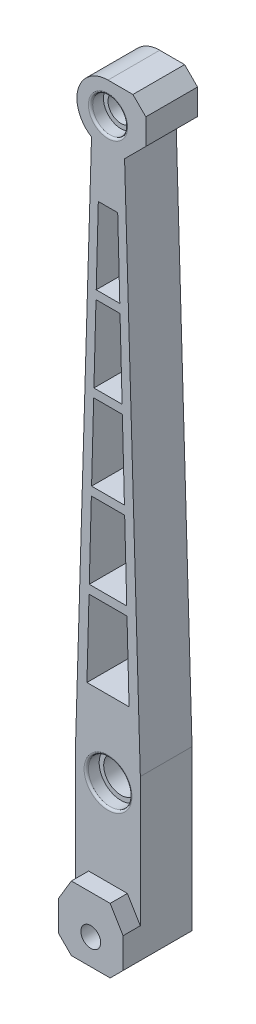
from build123d import *

# Parameters (mm, degrees)
SKETCH_1_R          = 2.3
EXTRUDE_1_DEPTH     = 12
SKETCH_2_R          = 5.05
CUT_EXTRUDE_1_DEPTH = 3
CUT_EXTRUDE_START   = -3
SKETCH_3_R          = 5.05
CUT_EXTRUDE_2_DEPTH = 3
SKETCH_4_R          = 4
CUT_EXTRUDE_3_DEPTH = 15
CUT_EXTRUDE_4_DEPTH = 15
CHAMFER_1_SIZE      = 3
EXTRUDE_2_DEPTH     = 12
SKETCH_8_R          = 3
CUT_EXTRUDE_5_DEPTH = 12
CHAMFER_2_SIZE      = 3
SKETCH_9_R          = 2.3
EXTRUDE_4_DEPTH     = 4
FILLET_1_R          = 0.5
CUT_EXTRUDE_6_DEPTH = 22
SKETCH_11_R         = 4.05
CUT_EXTRUDE_7_DEPTH = 3
FILLET_2_R          = 0.5


with BuildPart() as part:
    # 草图1 → 凸台-拉伸1 (new body)
    with BuildSketch(Plane.XY):
        Polygon((-3.615367776, 90), (-7.5, -40), (-7.5, -80), (7.5, -80), (7.5, -40), (3.615367776, 90), align=None)
        with Locations((0, -74)):
            Circle(SKETCH_1_R, mode=Mode.SUBTRACT)
    extrude(amount=EXTRUDE_1_DEPTH)

    # 草图2 → 切除-拉伸1 (cut)
    with BuildSketch(Plane.XY.offset(12)):
        with Locations((0, -45)):
            Circle(SKETCH_2_R)
    extrude(amount=-CUT_EXTRUDE_1_DEPTH, mode=Mode.SUBTRACT)

    # 草图3 → 切除-拉伸2 (cut)
    with BuildSketch(Plane(origin=(0, 0, 0), x_dir=(-1, 0, 0), z_dir=(0, 0, -1)).offset(CUT_EXTRUDE_START)):
        with Locations(Location((0, -45, 0), (0, 0, 180))):
            Circle(SKETCH_3_R)
    extrude(amount=CUT_EXTRUDE_2_DEPTH, mode=Mode.SUBTRACT)

    # 草图4 → 切除-拉伸3 (cut)
    with BuildSketch(Plane.XY.offset(9)):
        with Locations((0, -45)):
            Circle(SKETCH_4_R)
    extrude(amount=-CUT_EXTRUDE_3_DEPTH, mode=Mode.SUBTRACT)

    # 草图6 → 切除-拉伸4 (cut)
    with BuildSketch(Plane.XY.offset(12)):
        Polygon((4.888073513, -27.298220102), (4.403458128, -9.298220102), (-4.403458128, -9.298220102), (-4.888073513, -27.298220102), align=None)
        Polygon((-3.86499659, 10.701779898), (3.86499659, 10.701779898), (4.349611974, -7.298220102), (-4.349611974, -7.298220102), align=None)
        Polygon((-2.734227359, 52.701779898), (2.734227359, 52.701779898), (2.249611974, 70.701779898), (-2.249611974, 70.701779898), align=None)
        Polygon((-3.272688897, 32.701779898), (3.272688897, 32.701779898), (2.788073513, 50.701779898), (-2.788073513, 50.701779898), align=None)
        Polygon((-3.811150436, 12.701779898), (3.811150436, 12.701779898), (3.326535051, 30.701779898), (-3.326535051, 30.701779898), align=None)
    extrude(amount=-CUT_EXTRUDE_4_DEPTH, mode=Mode.SUBTRACT)

    # 倒角1
    chamfer_1_edges = [part.edges().sort_by_distance(p)[0] for p in [
        (7.5, -80, 6),
        (-7.5, -80, 6),
    ]]
    chamfer(chamfer_1_edges, length=CHAMFER_1_SIZE)

    # 草图7 → 凸台-拉伸2 (add)
    with BuildSketch(Plane.XY.offset(12)):
        Polygon((-3.844369998, 82.33639451), (3.844369998, 82.33639451), (8.779475305, 87.271499817), (8.779475305, 96.223058652), (-8.779475305, 96.223058652), (-8.779475305, 87.271499817), align=None)
    extrude(amount=-EXTRUDE_2_DEPTH)

    # 草图8 → 切除-拉伸5 (cut)
    with BuildSketch(Plane.XY.offset(12)):
        with Locations((0, 89)):
            Circle(SKETCH_8_R)
    extrude(amount=-CUT_EXTRUDE_5_DEPTH, mode=Mode.SUBTRACT)

    # 倒角2
    chamfer_2_edges = [part.edges().sort_by_distance(p)[0] for p in [
        (-8.779475305, 96.223058652, 6),
        (8.779475305, 96.223058652, 6),
    ]]
    chamfer(chamfer_2_edges, length=CHAMFER_2_SIZE)

    # 草图9 → 凸台-拉伸4 (add)
    with BuildSketch(Plane.XY.offset(12)):
        Polygon((-7.5, -70), (-4.5, -65), (4.5, -65), (7.5, -70), (7.5, -77), (4.5, -80), (-4.5, -80), (-7.5, -77), align=None)
        with Locations((0, -74)):
            Circle(SKETCH_9_R, mode=Mode.SUBTRACT)
    extrude(amount=EXTRUDE_4_DEPTH)

    # 圆角1
    fillet_1_edges = [part.edges().sort_by_distance(p)[0] for p in [
        (-5.05, -45, 12),
        (-5.05, -45, 0),
    ]]
    fillet(fillet_1_edges, radius=FILLET_1_R)

    # 草图10 → 切除-拉伸6 (cut)
    with BuildSketch(Plane.XY.offset(12)):
        with BuildLine():
            Line((-5.779475305, 96.223058652), (0, 96.223058652))
            ThreePointArc((0, 96.223058652), (-6.94052162, 91.000433937), (-3.844369998, 82.884986049))
            Line((-3.844369998, 82.884986049), (-3.844369998, 82.33639451))
            Line((-3.844369998, 82.33639451), (-8.779475305, 87.271499817))
            Line((-8.779475305, 87.271499817), (-8.779475305, 93.223058652))
            Line((-8.779475305, 93.223058652), (-5.779475305, 96.223058652))
        make_face()
    extrude(amount=-CUT_EXTRUDE_6_DEPTH, mode=Mode.SUBTRACT)

    # 草图11 → 切除-拉伸7 (cut)
    with BuildSketch(Plane.XY.offset(12)):
        with Locations((0, 89)):
            Circle(SKETCH_11_R)
    cut_extrude_7 = extrude(amount=-CUT_EXTRUDE_7_DEPTH, mode=Mode.SUBTRACT)

    # 镜向1: 切除-拉伸7 across plane
    add(cut_extrude_7.mirror(Plane.XY.offset(6)), mode=Mode.SUBTRACT)

    # 圆角2
    fillet_2_edges = [part.edges().sort_by_distance(p)[0] for p in [
        (-4.05, 89, 12),
        (-4.05, 89, 0),
    ]]
    fillet(fillet_2_edges, radius=FILLET_2_R)


solid = part.part
